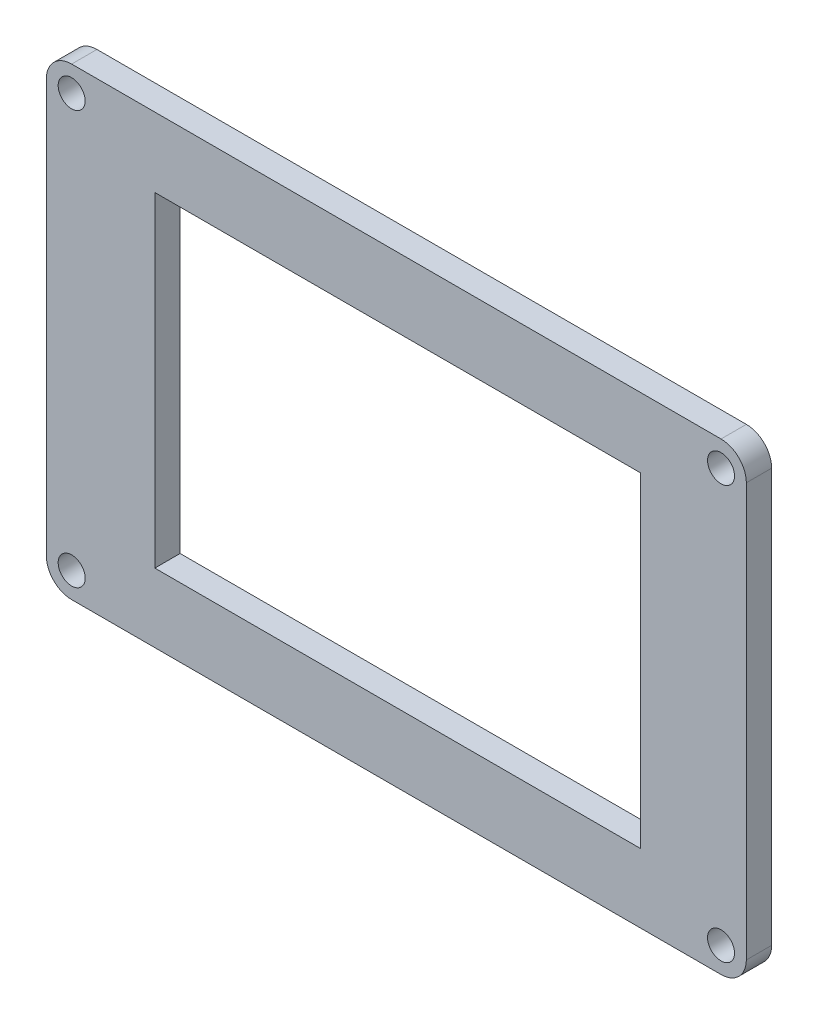
from build123d import *

# Parameters (mm, degrees)
SKETCH_1_R          = 1.6
EXTRUDE_1_DEPTH     = 3
SKETCH_3_W          = 57.604070615
SKETCH_3_H          = 38.574154429
CUT_EXTRUDE_1_DEPTH = 10


with BuildPart() as part:
    # 草图1 → 凸台-拉伸1 (new body)
    with BuildSketch(Plane.XY):
        with BuildLine():
            Line((0, -52), (77, -52))
            ThreePointArc((77, -52), (79.121320344, -51.121320344), (80, -49))
            Line((80, -49), (80, 0))
            ThreePointArc((80, 0), (79.121320344, 2.121320344), (77, 3))
            Line((77, 3), (0, 3))
            ThreePointArc((0, 3), (-2.121320344, 2.121320344), (-3, 0))
            Line((-3, 0), (-3, -49))
            ThreePointArc((-3, -49), (-2.121320344, -51.121320344), (0, -52))
        make_face()
        Circle(SKETCH_1_R, mode=Mode.SUBTRACT)
        with Locations((77, 0)):
            Circle(SKETCH_1_R, mode=Mode.SUBTRACT)
        with Locations((0, -49)):
            Circle(SKETCH_1_R, mode=Mode.SUBTRACT)
        with Locations((77, -49)):
            Circle(SKETCH_1_R, mode=Mode.SUBTRACT)
        with BuildLine():
            Line((16.5, -41.5), (60.5, -41.5))
            ThreePointArc((60.5, -41.5), (62.621320344, -40.621320344), (63.5, -38.5))
            Line((63.5, -38.5), (63.5, -10.5))
            ThreePointArc((63.5, -10.5), (62.621320344, -8.378679656), (60.5, -7.5))
            Line((60.5, -7.5), (16.5, -7.5))
            ThreePointArc((16.5, -7.5), (14.378679656, -8.378679656), (13.5, -10.5))
            Line((13.5, -10.5), (13.5, -38.5))
            ThreePointArc((13.5, -38.5), (14.378679656, -40.621320344), (16.5, -41.5))
        make_face(mode=Mode.SUBTRACT)
    extrude(amount=EXTRUDE_1_DEPTH)

    # 草图3 → 切除-拉伸1 (cut)
    with BuildSketch(Plane.XY.offset(3)):
        with Locations((38.662365372, -24.543784479)):
            Rectangle(SKETCH_3_W, SKETCH_3_H)
    extrude(amount=-CUT_EXTRUDE_1_DEPTH, mode=Mode.SUBTRACT)


solid = part.part
